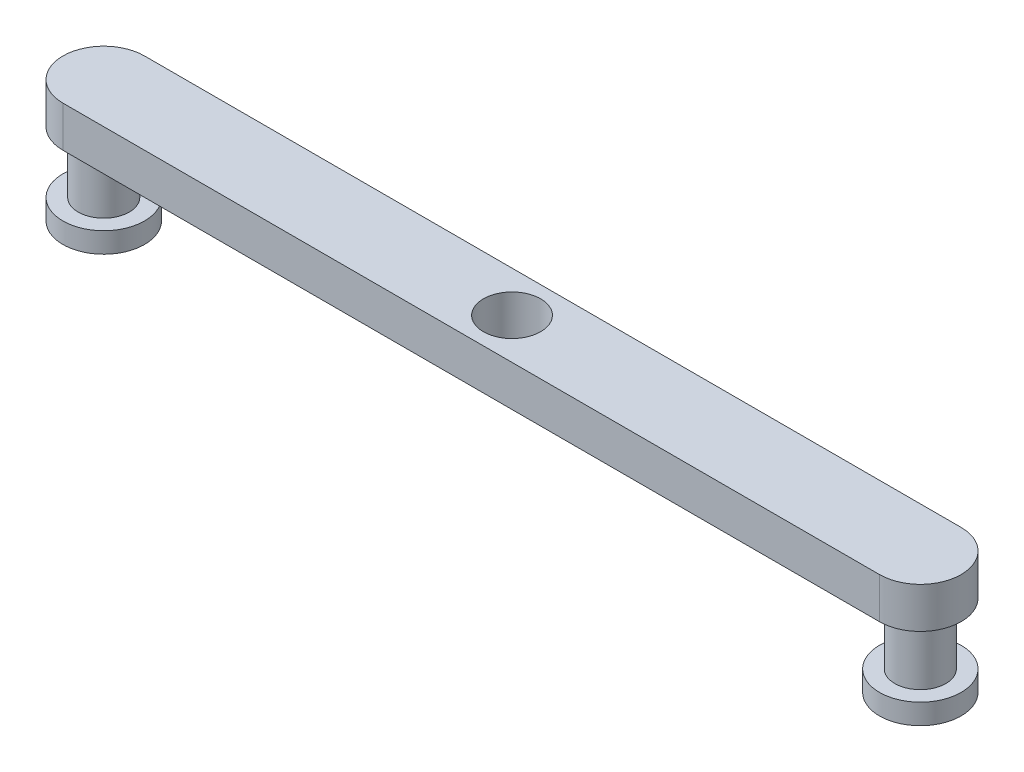
from build123d import *

# Parameters (mm, degrees)
BOSS_EXTRUDE1_DEPTH = 5.08
SKETCH3_R           = 3.175
BOSS_EXTRUDE2_DEPTH = 7.62
BOSS_EXTRUDE3_START = 2.54
SKETCH4_R           = 5.08
BOSS_EXTRUDE3_DEPTH = 2.54
SKETCH7_R           = 3.556
CUT_EXTRUDE1_DEPTH  = 5.08


with BuildPart() as part:
    # Sketch2 → Boss-Extrude1 (new body)
    with BuildSketch(Plane(origin=(0, 0, 0), x_dir=(1, 0, 0), z_dir=(0, 1, 0))):
        with BuildLine():
            Line((-50.8, -5.08), (50.8, -5.08))
            ThreePointArc((50.8, -5.08), (55.88, 0), (50.8, 5.08))
            Line((50.8, 5.08), (-50.8, 5.08))
            ThreePointArc((-50.8, 5.08), (-55.88, 0), (-50.8, -5.08))
        make_face()
    extrude(amount=BOSS_EXTRUDE1_DEPTH)

    # Sketch3 → Boss-Extrude2 (add)
    with BuildSketch(Plane.XZ):
        with Locations(Location((-50.8, 0, 0), (0, 0, 90))):
            Circle(SKETCH3_R)
        with Locations(Location((50.8, 0, 0), (0, 0, 90))):
            Circle(SKETCH3_R)
    extrude(amount=BOSS_EXTRUDE2_DEPTH)

    # Sketch4 → Boss-Extrude3 (add)
    with BuildSketch(Plane.XZ.offset(7.62).offset(BOSS_EXTRUDE3_START)):
        with Locations(Location((-50.8, 0, 0), (0, 0, 270))):
            Circle(SKETCH4_R)
        with Locations(Location((50.8, 0, 0), (0, 0, 270))):
            Circle(SKETCH4_R)
    extrude(amount=-BOSS_EXTRUDE3_DEPTH)

    # Sketch7 → Cut-Extrude1 (cut)
    with BuildSketch(Plane(origin=(0, 0, 0), x_dir=(1, 0, 0), z_dir=(0, 1, 0))):
        with Locations(Location((0, 0, 0), (0, 0, 270))):
            Circle(SKETCH7_R)
    extrude(amount=CUT_EXTRUDE1_DEPTH, mode=Mode.SUBTRACT)


solid = part.part
